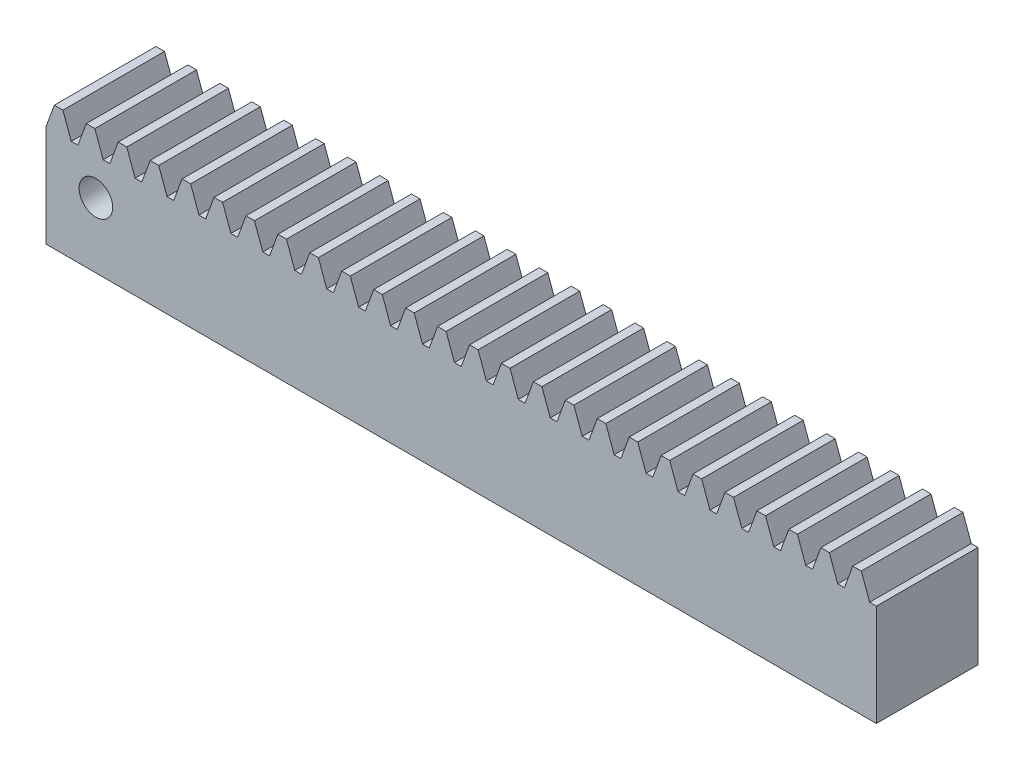
from build123d import *

# Parameters (mm, degrees)
SKETCH_1_W             = 81.681408993
SKETCH_1_H             = 10
EXTRUDE_1_DEPTH        = 30
EXTRUDE_2_DEPTH        = 30
PATTERN_LINEAR_1_COUNT = 26
PATTERN_LINEAR_1_PITCH = 3.141592654
SKETCH_3_W             = 87.309380436
SKETCH_3_H             = 21.857368967
CUT_EXTRUDE_1_DEPTH    = 20
SKETCH_4_R             = 1.65
CUT_EXTRUDE_4_DEPTH    = 83.8966379


with BuildPart() as part:
    # 草图1 → 拉伸1 (new body)
    with BuildSketch(Plane.XY):
        with Locations((40.840704497, -5)):
            Rectangle(SKETCH_1_W, SKETCH_1_H)
    extrude(amount=EXTRUDE_1_DEPTH)

    # 草图2 → 拉伸2 (add)
    with BuildSketch(Plane.XY.offset(30)):
        Polygon((0, 0), (0.818933027, 2.25), (1.661788885, 2.25), (2.480721912, 0), align=None)
    extrude_2 = extrude(amount=-EXTRUDE_2_DEPTH)

    # 阵列(线性)1: 拉伸2 ×26
    with Locations(*[(i * PATTERN_LINEAR_1_PITCH, 0, 0) for i in range(1, PATTERN_LINEAR_1_COUNT)]):
        add(extrude_2)

    # 草图3 → 切除-拉伸1 (cut)
    with BuildSketch(Plane(origin=(0, 0, 0), x_dir=(-1, 0, 0), z_dir=(0, 0, -1))):
        with Locations((-41.261038515, -3.604772773)):
            Rectangle(SKETCH_3_W, SKETCH_3_H)
    extrude(amount=-CUT_EXTRUDE_1_DEPTH, mode=Mode.SUBTRACT)

    # 草图4 → 切除-拉伸4 (cut, through all)
    with BuildSketch(Plane(origin=(0, 0, 20), x_dir=(-1, 0, 0), z_dir=(0, 0, -1))):
        with Locations((-4.906524017, -3.6)):
            Circle(SKETCH_4_R)
    extrude(amount=-CUT_EXTRUDE_4_DEPTH, mode=Mode.SUBTRACT)


solid = part.part
